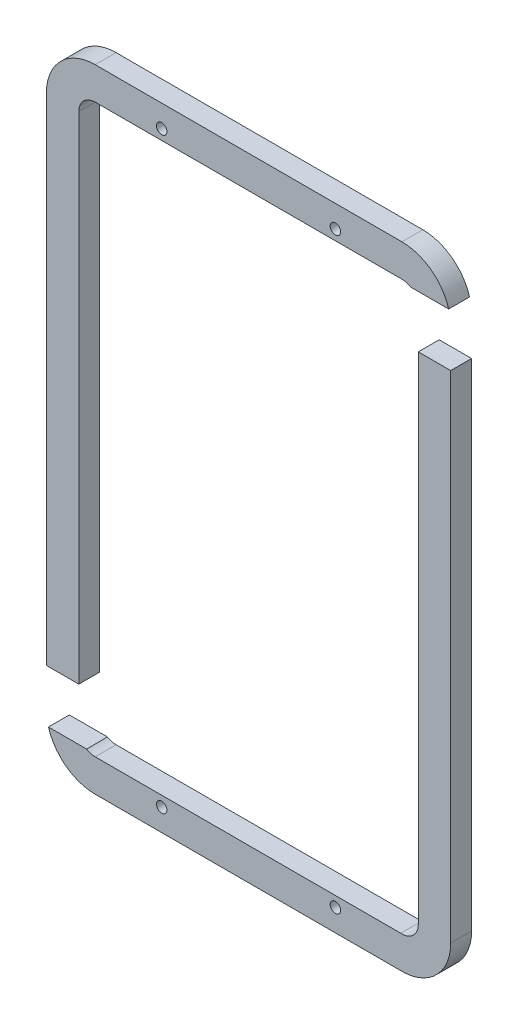
from build123d import *

# Parameters (mm, degrees)
SKETCH1_R             = 1.5
BOSS_EXTRUDE1_DEPTH   = 6
BOSS_EXTRUDE1_2_DEPTH = 6


with BuildPart() as part:
    # Sketch1 → Boss-Extrude1 (new body)
    with BuildSketch(Plane.XY):
        with BuildLine():
            Line((-61.222874487, -65.65), (-61.222874487, 76.66))
            ThreePointArc((-61.222874487, 76.66), (-57.122369424, 86.559494937), (-47.222874487, 90.66))
            Line((-47.222874487, 90.66), (40.797125513, 90.66))
            ThreePointArc((40.797125513, 90.66), (49.163725778, 87.88497216), (54.213533378, 80.66))
            Line((54.213533378, 80.66), (43.266962857, 80.66))
            ThreePointArc((43.266962857, 80.66), (42.080831206, 81.182410441), (40.797125513, 81.361073974))
            Line((40.797125513, 81.361073974), (-47.222874487, 81.361073974))
            ThreePointArc((-47.222874487, 81.361073974), (-50.547035773, 79.984161286), (-51.923948461, 76.66))
            Line((-51.923948461, 76.66), (-51.923948461, -65.65))
            Line((-51.923948461, -65.65), (-61.222874487, -65.65))
        make_face()
        with Locations((21.717125513, 84.31)):
            Circle(SKETCH1_R, mode=Mode.SUBTRACT)
        with Locations((-28.142874487, 84.31)):
            Circle(SKETCH1_R, mode=Mode.SUBTRACT)
    extrude(amount=BOSS_EXTRUDE1_DEPTH)


with BuildPart() as body_2:
    # Sketch1 → Boss-Extrude1 2 (new body)
    with BuildSketch(Plane.XY):
        with BuildLine():
            Line((54.797125513, 65.66), (54.797125513, -76.65))
            ThreePointArc((54.797125513, -76.65), (50.493730236, -86.760334141), (40.217127352, -90.65))
            Line((40.217127352, -90.65), (-47.222872648, -90.65))
            ThreePointArc((-47.222872648, -90.65), (-55.589474015, -87.87497271), (-60.639282352, -80.65))
            Line((-60.639282352, -80.65), (-49.692731257, -80.65))
            ThreePointArc((-49.692731257, -80.65), (-48.506590033, -81.172418254), (-47.222872648, -81.35108418))
            Line((-47.222872648, -81.35108418), (40.461175806, -81.35108418))
            ThreePointArc((40.461175806, -81.35108418), (44.004715911, -80.098818879), (45.498199487, -76.65))
            Line((45.498199487, -76.65), (45.498199487, 65.66))
            Line((45.498199487, 65.66), (54.797125513, 65.66))
        make_face()
        with Locations((-28.142874487, -84.31)):
            Circle(SKETCH1_R, mode=Mode.SUBTRACT)
        with Locations((21.717125513, -84.31)):
            Circle(SKETCH1_R, mode=Mode.SUBTRACT)
    extrude(amount=BOSS_EXTRUDE1_2_DEPTH)


solid = Compound([part.part, body_2.part])
